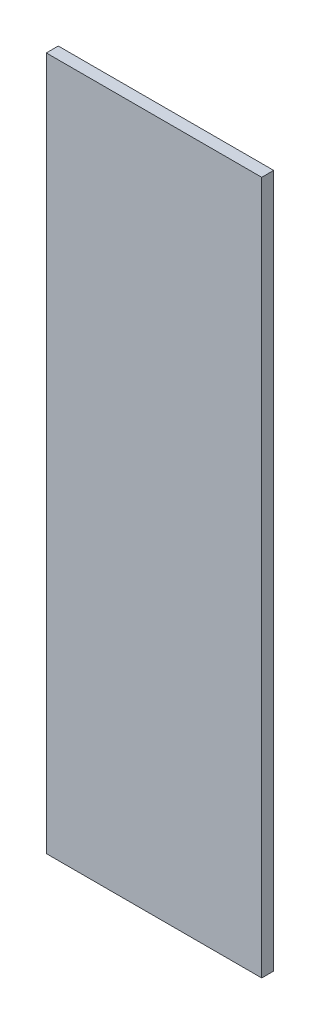
from build123d import *

# Parameters (mm, degrees)
SKETCH1_W           = 114.3
SKETCH1_H           = 367.919
BOSS_EXTRUDE1_DEPTH = 6.35


with BuildPart() as part:
    # Sketch1 → Boss-Extrude1 (new body)
    with BuildSketch(Plane.XY):
        Rectangle(SKETCH1_W, SKETCH1_H)
    extrude(amount=BOSS_EXTRUDE1_DEPTH)


solid = part.part
